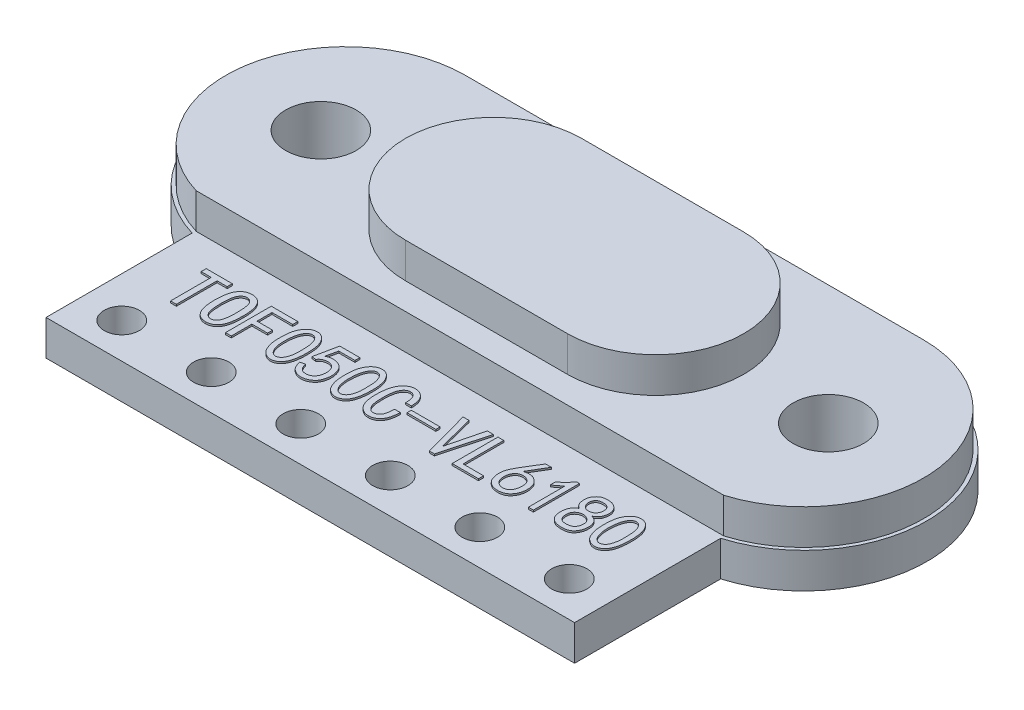
from build123d import *

# Parameters (mm, degrees)
EXTRUDE_1_DEPTH     = 1
EXTRUDE_3_DEPTH     = 1
EXTRUDE_4_DEPTH     = 1
SKETCH_4_R          = 1
CUT_EXTRUDE_1_DEPTH = 13.854960132
SKETCH_5_R          = 0.5
CUT_EXTRUDE_2_DEPTH = 13.658988901
SKETCH_6_W          = 0.818518518
SKETCH_6_H          = 0.121637426
EXTRUDE_5_DEPTH     = 0.05


with BuildPart() as part:
    # 草图1 → 凸台-拉伸1 (new body)
    with BuildSketch(Plane(origin=(0, 0, 0), x_dir=(1, 0, 0), z_dir=(0, 1, 0))):
        with BuildLine():
            Line((-6.5, 3.5), (6.5, 3.5))
            ThreePointArc((6.5, 3.5), (9.963333429, 0.505293538), (7.5, -3.354101966))
            Line((7.5, -3.354101966), (7.5, -7.5))
            Line((7.5, -7.5), (-7.5, -7.5))
            Line((-7.5, -7.5), (-7.5, -3.354101966))
            ThreePointArc((-7.5, -3.354101966), (-9.963333429, 0.505293538), (-6.5, 3.5))
        make_face()
    extrude(amount=EXTRUDE_1_DEPTH)

    # 草图2 → 凸台-拉伸3 (add)
    with BuildSketch(Plane(origin=(0, 1, 0), x_dir=(1, 0, 0), z_dir=(0, 1, 0))):
        with BuildLine():
            Line((-7.485302184, -3.254101966), (7.485302184, -3.254101966))
            ThreePointArc((7.485302184, -3.254101966), (9.863327719, 0.498022748), (6.5, 3.4))
            Line((6.5, 3.4), (-6.5, 3.4))
            ThreePointArc((-6.5, 3.4), (-9.863327719, 0.498022748), (-7.485302184, -3.254101966))
        make_face()
    extrude(amount=EXTRUDE_3_DEPTH)

    # 草图3 → 凸台-拉伸4 (add)
    with BuildSketch(Plane(origin=(0, 2, 0), x_dir=(1, 0, 0), z_dir=(0, 1, 0))):
        with BuildLine():
            Line((-2.3, 2.5), (2.3, 2.5))
            ThreePointArc((2.3, 2.5), (4.8, 0), (2.3, -2.5))
            Line((2.3, -2.5), (-2.3, -2.5))
            ThreePointArc((-2.3, -2.5), (-4.8, 0), (-2.3, 2.5))
        make_face()
    extrude(amount=EXTRUDE_4_DEPTH)

    # 草图4 → 切除-拉伸1 (cut, through all)
    with BuildSketch(Plane.XZ):
        with Locations(Location((-7.2, 0, 0), (0, 0, 270))):
            Circle(SKETCH_4_R)
        with Locations(Location((7.2, 0, 0), (0, 0, 270))):
            Circle(SKETCH_4_R)
    extrude(amount=-CUT_EXTRUDE_1_DEPTH, mode=Mode.SUBTRACT)

    # 草图5 → 切除-拉伸2 (cut, through all)
    with BuildSketch(Plane(origin=(0, 1, 0), x_dir=(1, 0, 0), z_dir=(0, 1, 0))):
        with Locations(Location((-6.35, -6.5, 0), (0, 0, 270))):
            Circle(SKETCH_5_R)
        with Locations(Location((-3.81, -6.5, 0), (0, 0, 270))):
            Circle(SKETCH_5_R)
        with Locations(Location((-1.27, -6.5, 0), (0, 0, 270))):
            Circle(SKETCH_5_R)
        with Locations(Location((1.27, -6.5, 0), (0, 0, 270))):
            Circle(SKETCH_5_R)
        with Locations(Location((3.81, -6.5, 0), (0, 0, 270))):
            Circle(SKETCH_5_R)
        with Locations(Location((6.35, -6.5, 0), (0, 0, 270))):
            Circle(SKETCH_5_R)
    extrude(amount=-CUT_EXTRUDE_2_DEPTH, mode=Mode.SUBTRACT)

    # 草图6 → 凸台-拉伸5 (add)
    # profile 1 of 14: a face of its own
    with BuildSketch(Plane(origin=(0, 1, 0), x_dir=(1, 0, 0), z_dir=(0, 1, 0))):
        with BuildLine():
            add(Edge.make_bspline(
                [(-3.633080442, -4.643944267), (-3.632330726, -4.627607531), (-3.63086882, -4.5957518), (-3.627147705, -4.549278769), (-3.622523731, -4.505297518), (-3.616261021, -4.463993877), (-3.609127974, -4.425322528), (-3.600247573, -4.389388095), (-3.590566583, -4.355971845), (-3.57604098, -4.315288984), (-3.554365395, -4.268527129), (-3.523773989, -4.216793228), (-3.487682356, -4.170680141), (-3.453885737, -4.13639764), (-3.424240438, -4.112640888), (-3.400765804, -4.097115691), (-3.376174937, -4.083698938), (-3.350189946, -4.073028683), (-3.32291437, -4.064845069), (-3.294453894, -4.058988666), (-3.264800874, -4.055277412), (-3.234276453, -4.054185292), (-3.203597885, -4.055696126), (-3.173488541, -4.060704433), (-3.144524388, -4.069623482), (-3.116491669, -4.08183178), (-3.089408684, -4.097301206), (-3.063516072, -4.116483431), (-3.038782845, -4.139179431), (-3.015013662, -4.164869397), (-2.993032587, -4.193347781), (-2.972234927, -4.223394889), (-2.954090882, -4.255666086), (-2.937610274, -4.28943796), (-2.92365032, -4.325221612), (-2.911142926, -4.362551431), (-2.901110615, -4.401826642), (-2.890141792, -4.457302648), (-2.880584106, -4.530865922), (-2.873491351, -4.62391753), (-2.871839589, -4.72317214), (-2.874112577, -4.809006098), (-2.878363663, -4.878567483), (-2.883401336, -4.929010253), (-2.890164727, -4.976902235), (-2.898382976, -5.022347805), (-2.907640223, -5.065415569), (-2.91941822, -5.105819701), (-2.932274416, -5.143818407), (-2.946515595, -5.179513744), (-2.962834746, -5.21245028), (-2.980994382, -5.242868466), (-3.000879215, -5.270801309), (-3.022910288, -5.296036893), (-3.047134343, -5.318378819), (-3.072932554, -5.338437864), (-3.100805688, -5.355731875), (-3.130141674, -5.370193632), (-3.160386096, -5.381979637), (-3.191192671, -5.389354946), (-3.221838159, -5.393948497), (-3.252567253, -5.39393759), (-3.283337892, -5.39111493), (-3.314006293, -5.383642225), (-3.344835419, -5.373442007), (-3.374869636, -5.358916735), (-3.403711227, -5.342086341), (-3.431137856, -5.324281817), (-3.456056052, -5.304723756), (-3.478588132, -5.283760821), (-3.499301496, -5.261817741), (-3.517722008, -5.238437087), (-3.533437949, -5.213460764), (-3.551802797, -5.178789561), (-3.570690532, -5.133563489), (-3.590786293, -5.078200294), (-3.606510204, -5.021270497), (-3.617576873, -4.972623081), (-3.623737112, -4.931671084), (-3.628098052, -4.89827964), (-3.63103011, -4.862191969), (-3.63326203, -4.823607513), (-3.634760146, -4.782393634), (-3.634779054, -4.738551181), (-3.634741378, -4.692081415), (-3.633643872, -4.660273557), (-3.633080442, -4.643944267)],
                knots=[0, 0, 0, 0, 1.202255831, 2.344332323, 3.427150622, 4.452790298, 5.415003786, 6.317070168, 7.172984564, 7.971810714, 9.490878293, 10.954732582, 12.380574024, 13.785796076, 14.483032935, 15.170088599, 15.852415483, 16.53926321, 17.231256195, 17.943090795, 18.673153424, 19.425791521, 20.185951937, 20.927853667, 21.663471394, 22.408255551, 23.171697317, 23.95146084, 24.772102557, 25.636403722, 26.521203059, 27.41499732, 28.320514408, 29.240196752, 30.175587258, 31.142244034, 32.133030811, 33.153387789, 35.298346624, 37.58196799, 40.011350989, 42.592982516, 43.892877383, 45.134258893, 46.318940759, 47.447766099, 48.529264423, 49.555762579, 50.539895176, 51.477852753, 52.378942115, 53.239267683, 54.079914708, 54.896514045, 55.697245284, 56.499135216, 57.295663269, 58.104176105, 58.901301703, 59.676164857, 60.428549859, 61.173813336, 61.929765436, 62.694702561, 63.488985814, 64.313130295, 65.141625222, 65.943515154, 66.715145528, 67.467119072, 68.204288601, 68.931737788, 69.651488187, 70.370742264, 71.814091361, 73.250214366, 74.698503296, 76.153483485, 76.914707982, 77.742340402, 78.62883324, 79.575783614, 80.583816845, 81.660284507, 82.798853591, 84, 84, 84, 84], degree=3))
        make_face()
        with BuildLine():
            add(Edge.make_bspline(
                [(-3.482159931, -4.598330232), (-3.483800652, -4.615495428), (-3.487033231, -4.649314621), (-3.48941825, -4.69948181), (-3.490342049, -4.748218019), (-3.489474891, -4.795550648), (-3.487098539, -4.841408961), (-3.482454757, -4.885822975), (-3.476403201, -4.928886342), (-3.468294162, -4.970331775), (-3.458440011, -5.009469152), (-3.447622719, -5.046058704), (-3.434961726, -5.079538917), (-3.420921194, -5.110065233), (-3.405447089, -5.137689683), (-3.388150331, -5.162111272), (-3.36997648, -5.184185065), (-3.349896321, -5.202527665), (-3.329524717, -5.218211678), (-3.308459602, -5.230185502), (-3.287326409, -5.238685255), (-3.266096278, -5.243974842), (-3.24470674, -5.245637595), (-3.223097472, -5.244007224), (-3.201497525, -5.238430112), (-3.180121276, -5.229658628), (-3.159458653, -5.217847638), (-3.139900492, -5.20347889), (-3.121992475, -5.186224334), (-3.105369119, -5.166574385), (-3.090485992, -5.144075769), (-3.076889018, -5.119261456), (-3.065150509, -5.091627074), (-3.050933958, -5.05128805), (-3.036586753, -4.997534266), (-3.024169596, -4.930314738), (-3.016913801, -4.860261168), (-3.014846491, -4.788401375), (-3.015584844, -4.716946421), (-3.017893034, -4.647765441), (-3.021260007, -4.581956545), (-3.025580129, -4.519211972), (-3.03343687, -4.459407664), (-3.046484708, -4.402480763), (-3.065739968, -4.348643605), (-3.085402336, -4.306115967), (-3.104219607, -4.275136928), (-3.119118088, -4.254542357), (-3.135454655, -4.237015394), (-3.153015088, -4.222446074), (-3.171718935, -4.211086003), (-3.191550479, -4.202734684), (-3.212528642, -4.197427717), (-3.234399614, -4.194903642), (-3.256519811, -4.195353254), (-3.278158979, -4.199381034), (-3.299043159, -4.206644038), (-3.319447409, -4.216738455), (-3.338903049, -4.230501603), (-3.357680962, -4.247338364), (-3.375584837, -4.267507325), (-3.393165435, -4.290598052), (-3.409439311, -4.317202439), (-3.424406361, -4.347123882), (-3.437476477, -4.380685843), (-3.449653403, -4.417469388), (-3.459896581, -4.457879117), (-3.468863014, -4.501572816), (-3.476507245, -4.548728921), (-3.480232584, -4.5814181), (-3.482159931, -4.598330232)],
                knots=[0, 0, 0, 0, 1.397316454, 2.753019234, 4.069157296, 5.347268292, 6.589031144, 7.78945144, 8.965229626, 10.112413484, 11.210110698, 12.235224056, 13.202966579, 14.108246767, 14.956441338, 15.764675174, 16.531168957, 17.268537609, 17.963781677, 18.611012722, 19.225453902, 19.804754603, 20.377071587, 20.956971254, 21.552864027, 22.177207148, 22.824438192, 23.477099645, 24.138873049, 24.835239721, 25.558866027, 26.321348508, 27.125383512, 27.989091723, 29.786373172, 31.627419599, 33.524192847, 35.487886982, 37.450446387, 39.315054396, 41.097335608, 42.790942677, 44.411021533, 45.981188455, 47.513666399, 49.037967233, 49.768516827, 50.448573276, 51.094372392, 51.705035266, 52.29207487, 52.861401646, 53.442547178, 54.039797782, 54.640911, 55.228738577, 55.81567961, 56.427998362, 57.06735936, 57.740746751, 58.467842942, 59.249806401, 60.089981822, 60.991451096, 61.957607916, 63.006379991, 64.129943241, 65.333828934, 66.620624917, 68, 68, 68, 68], degree=3))
        make_face(mode=Mode.SUBTRACT)
    # profile 2 of 14: a face of its own
    with BuildSketch(Plane(origin=(0, 1, 0), x_dir=(1, 0, 0), z_dir=(0, 1, 0))):
        with BuildLine():
            add(Edge.make_bspline(
                [(-1.795003769, -4.643944267), (-1.794254053, -4.627607531), (-1.792792147, -4.5957518), (-1.789071032, -4.549278769), (-1.784447058, -4.505297518), (-1.778184348, -4.463993877), (-1.771051301, -4.425322528), (-1.7621709, -4.389388095), (-1.75248991, -4.355971845), (-1.737964307, -4.315288984), (-1.716288722, -4.268527129), (-1.685697316, -4.216793228), (-1.649605683, -4.170680141), (-1.615809064, -4.13639764), (-1.586163765, -4.112640888), (-1.562689131, -4.097115691), (-1.538098264, -4.083698938), (-1.512113273, -4.073028683), (-1.484837697, -4.064845069), (-1.45637722, -4.058988666), (-1.426724201, -4.055277412), (-1.39619978, -4.054185292), (-1.365521212, -4.055696126), (-1.335411868, -4.060704433), (-1.306447715, -4.069623482), (-1.278414996, -4.08183178), (-1.251332011, -4.097301206), (-1.225439399, -4.116483431), (-1.200706172, -4.139179431), (-1.176936989, -4.164869397), (-1.154955914, -4.193347781), (-1.134158254, -4.223394889), (-1.116014209, -4.255666086), (-1.099533601, -4.28943796), (-1.085573647, -4.325221612), (-1.073066252, -4.362551431), (-1.063033942, -4.401826642), (-1.052065119, -4.457302648), (-1.042507433, -4.530865922), (-1.035414678, -4.62391753), (-1.033762915, -4.72317214), (-1.036035904, -4.809006098), (-1.04028699, -4.878567483), (-1.045324663, -4.929010253), (-1.052088054, -4.976902235), (-1.060306303, -5.022347805), (-1.069563549, -5.065415569), (-1.081341547, -5.105819701), (-1.094197743, -5.143818407), (-1.108438922, -5.179513744), (-1.124758073, -5.21245028), (-1.142917709, -5.242868466), (-1.162802542, -5.270801309), (-1.184833615, -5.296036893), (-1.209057669, -5.318378819), (-1.234855881, -5.338437864), (-1.262729015, -5.355731875), (-1.292065001, -5.370193632), (-1.322309423, -5.381979637), (-1.353115998, -5.389354946), (-1.383761486, -5.393948497), (-1.41449058, -5.39393759), (-1.445261219, -5.39111493), (-1.47592962, -5.383642225), (-1.506758746, -5.373442007), (-1.536792963, -5.358916735), (-1.565634554, -5.342086341), (-1.593061183, -5.324281817), (-1.617979379, -5.304723756), (-1.640511459, -5.283760821), (-1.661224823, -5.261817741), (-1.679645335, -5.238437087), (-1.695361275, -5.213460764), (-1.713726124, -5.178789561), (-1.732613859, -5.133563489), (-1.75270962, -5.078200294), (-1.76843353, -5.021270497), (-1.7795002, -4.972623081), (-1.785660439, -4.931671084), (-1.790021378, -4.89827964), (-1.792953437, -4.862191969), (-1.795185357, -4.823607513), (-1.796683473, -4.782393634), (-1.796702381, -4.738551181), (-1.796664705, -4.692081415), (-1.795567199, -4.660273557), (-1.795003769, -4.643944267)],
                knots=[0, 0, 0, 0, 1.202255831, 2.344332323, 3.427150622, 4.452790298, 5.415003786, 6.317070168, 7.172984564, 7.971810714, 9.490878293, 10.954732582, 12.380574024, 13.785796076, 14.483032935, 15.170088599, 15.852415483, 16.53926321, 17.231256195, 17.943090795, 18.673153424, 19.425791521, 20.185951937, 20.927853667, 21.663471394, 22.408255551, 23.171697317, 23.95146084, 24.772102557, 25.636403722, 26.521203059, 27.41499732, 28.320514408, 29.240196752, 30.175587258, 31.142244034, 32.133030811, 33.153387789, 35.298346624, 37.58196799, 40.011350989, 42.592982516, 43.892877383, 45.134258893, 46.318940759, 47.447766099, 48.529264423, 49.555762579, 50.539895176, 51.477852753, 52.378942115, 53.239267683, 54.079914708, 54.896514045, 55.697245284, 56.499135216, 57.295663269, 58.104176105, 58.901301703, 59.676164857, 60.428549859, 61.173813336, 61.929765436, 62.694702561, 63.488985814, 64.313130295, 65.141625222, 65.943515154, 66.715145528, 67.467119072, 68.204288601, 68.931737788, 69.651488187, 70.370742264, 71.814091361, 73.250214366, 74.698503296, 76.153483485, 76.914707982, 77.742340402, 78.62883324, 79.575783614, 80.583816845, 81.660284507, 82.798853591, 84, 84, 84, 84], degree=3))
        make_face()
        with BuildLine():
            add(Edge.make_bspline(
                [(-1.644083258, -4.598330232), (-1.645723979, -4.615495428), (-1.648956558, -4.649314621), (-1.651341577, -4.69948181), (-1.652265376, -4.748218019), (-1.651398218, -4.795550648), (-1.649021866, -4.841408961), (-1.644378083, -4.885822975), (-1.638326527, -4.928886342), (-1.630217489, -4.970331775), (-1.620363338, -5.009469152), (-1.609546046, -5.046058704), (-1.596885053, -5.079538917), (-1.582844521, -5.110065233), (-1.567370416, -5.137689683), (-1.550073657, -5.162111272), (-1.531899807, -5.184185065), (-1.511819648, -5.202527665), (-1.491448044, -5.218211678), (-1.470382929, -5.230185502), (-1.449249736, -5.238685255), (-1.428019605, -5.243974842), (-1.406630067, -5.245637595), (-1.385020799, -5.244007224), (-1.363420851, -5.238430112), (-1.342044603, -5.229658628), (-1.32138198, -5.217847638), (-1.301823819, -5.20347889), (-1.283915802, -5.186224334), (-1.267292446, -5.166574385), (-1.252409318, -5.144075769), (-1.238812345, -5.119261456), (-1.227073836, -5.091627074), (-1.212857285, -5.05128805), (-1.19851008, -4.997534266), (-1.186092923, -4.930314738), (-1.178837127, -4.860261168), (-1.176769818, -4.788401375), (-1.177508171, -4.716946421), (-1.179816361, -4.647765441), (-1.183183334, -4.581956545), (-1.187503456, -4.519211972), (-1.195360196, -4.459407664), (-1.208408035, -4.402480763), (-1.227663295, -4.348643605), (-1.247325663, -4.306115967), (-1.266142934, -4.275136928), (-1.281041415, -4.254542357), (-1.297377981, -4.237015394), (-1.314938414, -4.222446074), (-1.333642262, -4.211086003), (-1.353473806, -4.202734684), (-1.374451969, -4.197427717), (-1.396322941, -4.194903642), (-1.418443137, -4.195353254), (-1.440082306, -4.199381034), (-1.460966486, -4.206644038), (-1.481370735, -4.216738455), (-1.500826376, -4.230501603), (-1.519604288, -4.247338364), (-1.537508164, -4.267507325), (-1.555088762, -4.290598052), (-1.571362637, -4.317202439), (-1.586329688, -4.347123882), (-1.599399804, -4.380685843), (-1.61157673, -4.417469388), (-1.621819908, -4.457879117), (-1.63078634, -4.501572816), (-1.638430572, -4.548728921), (-1.64215591, -4.5814181), (-1.644083258, -4.598330232)],
                knots=[0, 0, 0, 0, 1.397316454, 2.753019234, 4.069157296, 5.347268292, 6.589031144, 7.78945144, 8.965229626, 10.112413484, 11.210110698, 12.235224056, 13.202966579, 14.108246767, 14.956441338, 15.764675174, 16.531168957, 17.268537609, 17.963781677, 18.611012722, 19.225453902, 19.804754603, 20.377071587, 20.956971254, 21.552864027, 22.177207148, 22.824438192, 23.477099645, 24.138873049, 24.835239721, 25.558866027, 26.321348508, 27.125383512, 27.989091723, 29.786373172, 31.627419599, 33.524192847, 35.487886982, 37.450446387, 39.315054396, 41.097335608, 42.790942677, 44.411021533, 45.981188455, 47.513666399, 49.037967233, 49.768516827, 50.448573276, 51.094372392, 51.705035266, 52.29207487, 52.861401646, 53.442547178, 54.039797782, 54.640911, 55.228738577, 55.81567961, 56.427998362, 57.06735936, 57.740746751, 58.467842942, 59.249806401, 60.089981822, 60.991451096, 61.957607916, 63.006379991, 64.129943241, 65.333828934, 66.620624917, 68, 68, 68, 68], degree=3))
        make_face(mode=Mode.SUBTRACT)
    # profile 3 of 14: a face of its own
    with BuildSketch(Plane(origin=(0, 1, 0), x_dir=(1, 0, 0), z_dir=(0, 1, 0))):
        with BuildLine():
            add(Edge.make_bspline(
                [(5.557302923, -4.643944267), (5.55805264, -4.627607531), (5.559514546, -4.5957518), (5.563235661, -4.549278769), (5.567859635, -4.505297518), (5.574122345, -4.463993877), (5.581255392, -4.425322528), (5.590135793, -4.389388095), (5.599816783, -4.355971845), (5.614342386, -4.315288984), (5.636017971, -4.268527129), (5.666609377, -4.216793228), (5.70270101, -4.170680141), (5.736497629, -4.13639764), (5.766142928, -4.112640888), (5.789617561, -4.097115691), (5.814208429, -4.083698938), (5.84019342, -4.073028683), (5.867468996, -4.064845069), (5.895929472, -4.058988666), (5.925582492, -4.055277412), (5.956106913, -4.054185292), (5.986785481, -4.055696126), (6.016894824, -4.060704433), (6.045858977, -4.069623482), (6.073891697, -4.08183178), (6.100974682, -4.097301206), (6.126867294, -4.116483431), (6.151600521, -4.139179431), (6.175369703, -4.164869397), (6.197350779, -4.193347781), (6.218148439, -4.223394889), (6.236292484, -4.255666086), (6.252773092, -4.28943796), (6.266733046, -4.325221612), (6.27924044, -4.362551431), (6.289272751, -4.401826642), (6.300241574, -4.457302648), (6.30979926, -4.530865922), (6.316892014, -4.62391753), (6.318543777, -4.72317214), (6.316270788, -4.809006098), (6.312019703, -4.878567483), (6.30698203, -4.929010253), (6.300218638, -4.976902235), (6.29200039, -5.022347805), (6.282743143, -5.065415569), (6.270965146, -5.105819701), (6.258108949, -5.143818407), (6.243867771, -5.179513744), (6.22754862, -5.21245028), (6.209388984, -5.242868466), (6.189504151, -5.270801309), (6.167473078, -5.296036893), (6.143249023, -5.318378819), (6.117450811, -5.338437864), (6.089577677, -5.355731875), (6.060241692, -5.370193632), (6.02999727, -5.381979637), (5.999190695, -5.389354946), (5.968545207, -5.393948497), (5.937816113, -5.39393759), (5.907045474, -5.39111493), (5.876377072, -5.383642225), (5.845547947, -5.373442007), (5.81551373, -5.358916735), (5.786672139, -5.342086341), (5.75924551, -5.324281817), (5.734327313, -5.304723756), (5.711795234, -5.283760821), (5.69108187, -5.261817741), (5.672661358, -5.238437087), (5.656945417, -5.213460764), (5.638580568, -5.178789561), (5.619692834, -5.133563489), (5.599597073, -5.078200294), (5.583873162, -5.021270497), (5.572806493, -4.972623081), (5.566646254, -4.931671084), (5.562285314, -4.89827964), (5.559353256, -4.862191969), (5.557121336, -4.823607513), (5.55562322, -4.782393634), (5.555604312, -4.738551181), (5.555641987, -4.692081415), (5.556739493, -4.660273557), (5.557302923, -4.643944267)],
                knots=[0, 0, 0, 0, 1.202255831, 2.344332323, 3.427150622, 4.452790298, 5.415003786, 6.317070168, 7.172984564, 7.971810714, 9.490878293, 10.954732582, 12.380574024, 13.785796076, 14.483032935, 15.170088599, 15.852415483, 16.53926321, 17.231256195, 17.943090795, 18.673153424, 19.425791521, 20.185951937, 20.927853667, 21.663471394, 22.408255551, 23.171697317, 23.95146084, 24.772102557, 25.636403722, 26.521203059, 27.41499732, 28.320514408, 29.240196752, 30.175587258, 31.142244034, 32.133030811, 33.153387789, 35.298346624, 37.58196799, 40.011350989, 42.592982516, 43.892877383, 45.134258893, 46.318940759, 47.447766099, 48.529264423, 49.555762579, 50.539895176, 51.477852753, 52.378942115, 53.239267683, 54.079914708, 54.896514045, 55.697245284, 56.499135216, 57.295663269, 58.104176105, 58.901301703, 59.676164857, 60.428549859, 61.173813336, 61.929765436, 62.694702561, 63.488985814, 64.313130295, 65.141625222, 65.943515154, 66.715145528, 67.467119072, 68.204288601, 68.931737788, 69.651488187, 70.370742264, 71.814091361, 73.250214366, 74.698503296, 76.153483485, 76.914707982, 77.742340402, 78.62883324, 79.575783614, 80.583816845, 81.660284507, 82.798853591, 84, 84, 84, 84], degree=3))
        make_face()
        with BuildLine():
            add(Edge.make_bspline(
                [(5.708223435, -4.598330232), (5.706582714, -4.615495428), (5.703350135, -4.649314621), (5.700965116, -4.69948181), (5.700041316, -4.748218019), (5.700908474, -4.795550648), (5.703284827, -4.841408961), (5.707928609, -4.885822975), (5.713980165, -4.928886342), (5.722089204, -4.970331775), (5.731943354, -5.009469152), (5.742760646, -5.046058704), (5.755421639, -5.079538917), (5.769462172, -5.110065233), (5.784936277, -5.137689683), (5.802233035, -5.162111272), (5.820406886, -5.184185065), (5.840487045, -5.202527665), (5.860858649, -5.218211678), (5.881923764, -5.230185502), (5.903056957, -5.238685255), (5.924287087, -5.243974842), (5.945676626, -5.245637595), (5.967285894, -5.244007224), (5.988885841, -5.238430112), (6.01026209, -5.229658628), (6.030924712, -5.217847638), (6.050482874, -5.20347889), (6.068390891, -5.186224334), (6.085014247, -5.166574385), (6.099897374, -5.144075769), (6.113494347, -5.119261456), (6.125232857, -5.091627074), (6.139449408, -5.05128805), (6.153796613, -4.997534266), (6.16621377, -4.930314738), (6.173469565, -4.860261168), (6.175536875, -4.788401375), (6.174798522, -4.716946421), (6.172490331, -4.647765441), (6.169123359, -4.581956545), (6.164803237, -4.519211972), (6.156946496, -4.459407664), (6.143898658, -4.402480763), (6.124643398, -4.348643605), (6.104981029, -4.306115967), (6.086163759, -4.275136928), (6.071265278, -4.254542357), (6.054928711, -4.237015394), (6.037368278, -4.222446074), (6.018664431, -4.211086003), (5.998832887, -4.202734684), (5.977854724, -4.197427717), (5.955983751, -4.194903642), (5.933863555, -4.195353254), (5.912224386, -4.199381034), (5.891340206, -4.206644038), (5.870935957, -4.216738455), (5.851480316, -4.230501603), (5.832702404, -4.247338364), (5.814798529, -4.267507325), (5.79721793, -4.290598052), (5.780944055, -4.317202439), (5.765977005, -4.347123882), (5.752906889, -4.380685843), (5.740729963, -4.417469388), (5.730486784, -4.457879117), (5.721520352, -4.501572816), (5.713876121, -4.548728921), (5.710150782, -4.5814181), (5.708223435, -4.598330232)],
                knots=[0, 0, 0, 0, 1.397316454, 2.753019234, 4.069157296, 5.347268292, 6.589031144, 7.78945144, 8.965229626, 10.112413484, 11.210110698, 12.235224056, 13.202966579, 14.108246767, 14.956441338, 15.764675174, 16.531168957, 17.268537609, 17.963781677, 18.611012722, 19.225453902, 19.804754603, 20.377071587, 20.956971254, 21.552864027, 22.177207148, 22.824438192, 23.477099645, 24.138873049, 24.835239721, 25.558866027, 26.321348508, 27.125383512, 27.989091723, 29.786373172, 31.627419599, 33.524192847, 35.487886982, 37.450446387, 39.315054396, 41.097335608, 42.790942677, 44.411021533, 45.981188455, 47.513666399, 49.037967233, 49.768516827, 50.448573276, 51.094372392, 51.705035266, 52.29207487, 52.861401646, 53.442547178, 54.039797782, 54.640911, 55.228738577, 55.81567961, 56.427998362, 57.06735936, 57.740746751, 58.467842942, 59.249806401, 60.089981822, 60.991451096, 61.957607916, 63.006379991, 64.129943241, 65.333828934, 66.620624917, 68, 68, 68, 68], degree=3))
        make_face(mode=Mode.SUBTRACT)
    # profile 4 of 14: a face of its own
    with BuildSketch(Plane(origin=(0, 1, 0), x_dir=(1, 0, 0), z_dir=(0, 1, 0))):
        Polygon((-5.636156033, -4.221873658), (-5.923355513, -4.221873658), (-5.923355513, -5.377429214), (-6.08835443, -5.377429214), (-6.08835443, -4.221873658), (-6.37555391, -4.221873658), (-6.37555391, -4.077429214), (-5.636156033, -4.077429214), align=None)
    # profile 5 of 14: a face of its own
    with BuildSketch(Plane(origin=(0, 1, 0), x_dir=(1, 0, 0), z_dir=(0, 1, 0))):
        with BuildLine():
            add(Edge.make_bspline(
                [(-4.688397748, -4.723628044), (-4.6887293, -4.752353899), (-4.689369059, -4.807782938), (-4.69403033, -4.887764176), (-4.702205629, -4.961428143), (-4.713073403, -5.028971075), (-4.728090014, -5.090063154), (-4.745567213, -5.145134939), (-4.766583859, -5.193946224), (-4.791241197, -5.236548732), (-4.818744622, -5.273508689), (-4.848787579, -5.305385118), (-4.881393867, -5.332374062), (-4.916575431, -5.354691241), (-4.954683728, -5.371588317), (-4.995270148, -5.383699719), (-5.038392816, -5.391204748), (-5.068014635, -5.392150472), (-5.083156249, -5.392633892)],
                knots=[0, 0, 0, 0, 1.575814199, 3.040670848, 4.392759093, 5.640420767, 6.790536865, 7.84073895, 8.806849797, 9.699660947, 10.534787483, 11.328761039, 12.096767937, 12.851017334, 13.606951893, 14.375786756, 15.169760312, 16, 16, 16, 16], degree=3))
            add(Edge.make_bspline(
                [(-5.083156249, -5.392633892), (-5.098297404, -5.392145883), (-5.128010886, -5.391188197), (-5.171318757, -5.383697527), (-5.212189538, -5.371597016), (-5.250632469, -5.354635617), (-5.286346191, -5.332317453), (-5.319761874, -5.305423026), (-5.350656925, -5.273547833), (-5.378987678, -5.236586562), (-5.404595405, -5.194071062), (-5.42597206, -5.14508936), (-5.444702396, -5.090243153), (-5.459194267, -5.028884731), (-5.471035871, -4.961485775), (-5.479267397, -4.887762164), (-5.484358059, -4.807795476), (-5.484936025, -4.752356208), (-5.485235522, -4.723628044)],
                knots=[0, 0, 0, 0, 0.826368182, 1.621691169, 2.391849926, 3.148939623, 3.908367225, 4.684707456, 5.485624427, 6.326141133, 7.222601148, 8.188349311, 9.238504517, 10.383257488, 11.626834111, 12.973192974, 14.431534009, 16, 16, 16, 16], degree=3))
            add(Edge.make_bspline(
                [(-5.485235522, -4.723628044), (-5.484937464, -4.694899888), (-5.484363249, -4.63955431), (-5.479272499, -4.559773919), (-5.471023318, -4.486334963), (-5.459273879, -4.419383713), (-5.444663629, -4.358607322), (-5.425953417, -4.304423573), (-5.404755071, -4.256072148), (-5.378885409, -4.214548852), (-5.350670175, -4.178438214), (-5.319650675, -4.147448586), (-5.286345932, -4.121081002), (-5.250533975, -4.099419485), (-5.212186968, -4.082653088), (-5.171268035, -4.070975307), (-5.128025828, -4.063295366), (-5.098300838, -4.062585967), (-5.083156249, -4.062224536)],
                knots=[0, 0, 0, 0, 1.578860414, 3.041717743, 4.391874286, 5.638611742, 6.775922934, 7.823275337, 8.786016059, 9.670786588, 10.504660206, 11.299867464, 12.074924174, 12.834004698, 13.594031204, 14.367833651, 15.168427344, 16, 16, 16, 16], degree=3))
            add(Edge.make_bspline(
                [(-5.083156249, -4.062224536), (-5.068011161, -4.062581244), (-5.038377808, -4.063279191), (-4.995321201, -4.070972784), (-4.954686138, -4.082661722), (-4.916675625, -4.09936367), (-4.881395524, -4.121024845), (-4.848897976, -4.147483288), (-4.818730525, -4.178477885), (-4.791341234, -4.214584074), (-4.766424498, -4.256202268), (-4.74558598, -4.304376972), (-4.728126218, -4.358788548), (-4.712995394, -4.419297048), (-4.702218558, -4.486392998), (-4.694025175, -4.559771853), (-4.689364275, -4.639566934), (-4.688728035, -4.694902222), (-4.688397748, -4.723628044)],
                knots=[0, 0, 0, 0, 0.835532803, 1.634829595, 2.407342517, 3.166241811, 3.920079529, 4.686674999, 5.474750598, 6.303065712, 7.183989486, 8.147084175, 9.194472646, 10.337199986, 11.588114816, 12.944116777, 14.413620675, 16, 16, 16, 16], degree=3))
        make_face()
        with BuildLine():
            add(Edge.make_bspline(
                [(-4.860717436, -4.723628044), (-4.860973261, -4.698191449), (-4.86146242, -4.649554481), (-4.864037396, -4.580039272), (-4.869128497, -4.517395696), (-4.875845069, -4.461508371), (-4.885154191, -4.412548743), (-4.895733937, -4.370281065), (-4.908818895, -4.334963222), (-4.92423079, -4.306101062), (-4.941509644, -4.282668616), (-4.958727365, -4.262215958), (-4.97720524, -4.245136678), (-4.996585509, -4.231156299), (-5.016824859, -4.219954564), (-5.038279397, -4.212486345), (-5.060382859, -4.207297718), (-5.07552364, -4.206879705), (-5.083156249, -4.20666898)],
                knots=[0, 0, 0, 0, 1.963269092, 3.753940191, 5.367329203, 6.812978459, 8.095858007, 9.211536051, 10.172118002, 10.995359499, 11.727121309, 12.41539158, 13.056166358, 13.663302938, 14.256450332, 14.833863709, 15.412139745, 16, 16, 16, 16], degree=3))
            add(Edge.make_bspline(
                [(-5.083156249, -4.20666898), (-5.090884413, -4.20687071), (-5.106122381, -4.207268471), (-5.12838901, -4.212538554), (-5.150060205, -4.219921696), (-5.170637548, -4.231315167), (-5.190777991, -4.244995919), (-5.20982425, -4.262287012), (-5.227915303, -4.282618463), (-5.24601301, -4.306049135), (-5.262363342, -4.334831508), (-5.275914583, -4.370258327), (-5.287196945, -4.412483618), (-5.29655961, -4.461529317), (-5.30408364, -4.517357702), (-5.309273713, -4.580038396), (-5.312264078, -4.649546178), (-5.312692035, -4.698189967), (-5.312915833, -4.723628044)],
                knots=[0, 0, 0, 0, 0.591398625, 1.166087189, 1.746696835, 2.34250422, 2.963523994, 3.610976646, 4.309261031, 5.049304105, 5.877917875, 6.837737957, 7.950227515, 9.226509397, 10.665064709, 12.269042512, 14.048910508, 16, 16, 16, 16], degree=3))
            add(Edge.make_bspline(
                [(-5.312915833, -4.723628044), (-5.312690259, -4.749066029), (-5.312258075, -4.797803405), (-5.309278177, -4.867499452), (-5.304057515, -4.93055142), (-5.296584369, -4.986760106), (-5.287176295, -5.036269734), (-5.27578743, -5.07909786), (-5.262426854, -5.115426829), (-5.245981615, -5.145089105), (-5.228021269, -5.169395294), (-5.209721244, -5.190278433), (-5.190885037, -5.208424359), (-5.170717961, -5.222707724), (-5.150065342, -5.234325061), (-5.128446698, -5.242125157), (-5.106104858, -5.247217638), (-5.090880573, -5.247862344), (-5.083156249, -5.248189448)],
                knots=[0, 0, 0, 0, 1.93265765, 3.702835093, 5.298765143, 6.737862613, 8.009086707, 9.124823572, 10.102159662, 10.941597642, 11.691824365, 12.394163048, 13.049964202, 13.673328396, 14.266900684, 14.844451572, 15.413711083, 16, 16, 16, 16], degree=3))
            add(Edge.make_bspline(
                [(-5.083156249, -5.248189448), (-5.075527527, -5.247853508), (-5.060400717, -5.247187379), (-5.03822056, -5.242178161), (-5.016820432, -5.234291979), (-4.996499426, -5.222866196), (-4.977103976, -5.208277874), (-4.958827379, -5.190353669), (-4.941406492, -5.169340496), (-4.924263347, -5.145039191), (-4.908760314, -5.115295505), (-4.895856653, -5.079078881), (-4.885173828, -5.036205503), (-4.87582156, -4.986780551), (-4.869152996, -4.930514097), (-4.864033299, -4.867498471), (-4.861467868, -4.797795188), (-4.860974806, -4.749064572), (-4.860717436, -4.723628044)],
                knots=[0, 0, 0, 0, 0.582703218, 1.155428208, 1.729768534, 2.320672757, 2.930480733, 3.579895491, 4.272494922, 5.014809166, 5.849148678, 6.827396544, 7.946251568, 9.223865636, 10.669874188, 12.274926644, 14.055576917, 16, 16, 16, 16], degree=3))
        make_face(mode=Mode.SUBTRACT)
    # profile 6 of 14: a face of its own
    with BuildSketch(Plane(origin=(0, 1, 0), x_dir=(1, 0, 0), z_dir=(0, 1, 0))):
        Polygon((-3.776398614, -4.221873658), (-4.365157549, -4.221873658), (-4.365157549, -4.647604653), (-3.919998355, -4.647604653), (-3.919998355, -4.792049097), (-4.365157549, -4.792049097), (-4.365157549, -5.377429214), (-4.530438034, -5.377429214), (-4.530438034, -4.077429214), (-3.776398614, -4.077429214), align=None)
    # profile 7 of 14: a face of its own
    with BuildSketch(Plane(origin=(0, 1, 0), x_dir=(1, 0, 0), z_dir=(0, 1, 0))):
        with BuildLine():
            add(Edge.make_bspline(
                [(-2.620561491, -5.012516933), (-2.616205016, -5.028732716), (-2.60790266, -5.059635957), (-2.592233825, -5.102748421), (-2.574084129, -5.140154449), (-2.553446234, -5.171764378), (-2.53083897, -5.197946437), (-2.505684532, -5.218437239), (-2.478058877, -5.233175271), (-2.44843956, -5.241194692), (-2.418974212, -5.24532154), (-2.390567917, -5.247590696), (-2.363628175, -5.248126716), (-2.338176724, -5.245792798), (-2.314093336, -5.24138109), (-2.291518671, -5.234487637), (-2.270141214, -5.225981131), (-2.244512946, -5.210683453), (-2.215670633, -5.188383354), (-2.185396151, -5.157923544), (-2.160775605, -5.123290894), (-2.142072024, -5.084898898), (-2.127940526, -5.043636332), (-2.118893031, -4.999721611), (-2.113673458, -4.953625636), (-2.113590573, -4.906172016), (-2.117652144, -4.859368102), (-2.127412683, -4.815128235), (-2.143018819, -4.77485416), (-2.163521732, -4.7386723), (-2.18840021, -4.707440313), (-2.216267812, -4.680869634), (-2.248261585, -4.661074383), (-2.282804858, -4.646432402), (-2.320282557, -4.6382344), (-2.359930906, -4.634880575), (-2.401816502, -4.63866306), (-2.437714576, -4.645181015), (-2.466497325, -4.653999013), (-2.487545968, -4.662491364), (-2.507578899, -4.672892125), (-2.526567595, -4.685431612), (-2.54453549, -4.699787516), (-2.561566456, -4.715920685), (-2.577424944, -4.734077395), (-2.586970791, -4.747293769), (-2.591841543, -4.754037401)],
                knots=[0, 0, 0, 0, 1.440772756, 2.745753867, 3.931089201, 5.001362436, 5.97747551, 6.888379651, 7.771243662, 8.643234641, 9.506849525, 10.323059292, 11.088426718, 11.816330219, 12.513120585, 13.185981879, 13.839764201, 14.482281771, 15.740703251, 16.959805272, 18.155715406, 19.369856395, 20.613101394, 21.889776103, 23.210895096, 24.5885037, 25.956064657, 27.236191491, 28.462961981, 29.6500481, 30.791195886, 31.879955865, 32.937142085, 34.00240088, 35.085063659, 36.216387077, 37.403937813, 38.683709712, 39.341154709, 39.984429399, 40.629416939, 41.275158704, 41.934427407, 42.601135756, 43.286231893, 44, 44, 44, 44], degree=3))
            Line((-2.591841543, -4.754037401), (-2.713760538, -4.738832723))
            add(Edge.make_bspline(
                [(-2.713760538, -4.738832723), (-2.712991971, -4.736209502), (-2.711026386, -4.729500699), (-2.708091138, -4.71716045), (-2.704005489, -4.700508003), (-2.699766764, -4.67938245), (-2.69393228, -4.654013019), (-2.687530717, -4.624149933), (-2.680208923, -4.589798977), (-2.672032811, -4.551151535), (-2.663367135, -4.508019904), (-2.65349468, -4.460645623), (-2.642680066, -4.408785544), (-2.631637967, -4.352482953), (-2.619103246, -4.291900583), (-2.605808518, -4.22688923), (-2.592214106, -4.157357524), (-2.582489164, -4.109615178), (-2.577481569, -4.085031553)],
                knots=[0, 0, 0, 0, 0.1964209, 0.502340227, 0.91135273, 1.428620429, 2.050489893, 2.782110173, 3.623494787, 4.574652573, 5.621016364, 6.785131302, 8.052424553, 9.428164775, 10.908423118, 12.498470141, 14.196982245, 16, 16, 16, 16], degree=3))
            Line((-2.577481569, -4.085031553), (-2.010121811, -4.085031553))
            Line((-2.010121811, -4.085031553), (-2.010121811, -4.221873658))
            Line((-2.010121811, -4.221873658), (-2.46964098, -4.221873658))
            add(Edge.make_bspline(
                [(-2.46964098, -4.221873658), (-2.47260723, -4.238586809), (-2.478378454, -4.271104412), (-2.487426029, -4.31849783), (-2.496432684, -4.363269855), (-2.505349025, -4.405436149), (-2.514509519, -4.444895855), (-2.523045303, -4.481876908), (-2.53209494, -4.51620505), (-2.538400478, -4.53817897), (-2.54144085, -4.548774243)],
                knots=[0, 0, 0, 0, 1.216602525, 2.367057976, 3.458098476, 4.489855192, 5.455924242, 6.361499988, 7.209956349, 8, 8, 8, 8], degree=3))
            add(Edge.make_bspline(
                [(-2.54144085, -4.548774243), (-2.523966014, -4.540654043), (-2.490348846, -4.525032829), (-2.438850488, -4.50920327), (-2.389210197, -4.500070845), (-2.341050845, -4.498466325), (-2.294358305, -4.503000688), (-2.248734497, -4.511861077), (-2.204074793, -4.525970292), (-2.161028448, -4.544178458), (-2.121002116, -4.56648274), (-2.08610741, -4.593144442), (-2.057034927, -4.623836446), (-2.034974742, -4.658698984), (-2.016735612, -4.694670747), (-2.000754128, -4.730808868), (-1.987876305, -4.767069818), (-1.977559623, -4.803556325), (-1.969956937, -4.84063186), (-1.964789976, -4.878911689), (-1.962630803, -4.91863246), (-1.963200967, -4.959651255), (-1.966684023, -5.001583103), (-1.972622946, -5.044304647), (-1.982909623, -5.08733364), (-1.995045885, -5.130440596), (-2.010795966, -5.171946606), (-2.030597405, -5.210229086), (-2.053982255, -5.244869038), (-2.081348025, -5.275531224), (-2.112071031, -5.302515772), (-2.145541529, -5.32714672), (-2.182553704, -5.348228414), (-2.222196697, -5.367168685), (-2.265236926, -5.381592159), (-2.31156704, -5.390950423), (-2.361072668, -5.39452499), (-2.404066005, -5.393898968), (-2.439292088, -5.389877106), (-2.465729701, -5.384775289), (-2.491916146, -5.377841889), (-2.517555678, -5.367986131), (-2.543106101, -5.356566082), (-2.568306809, -5.343033627), (-2.592908127, -5.327000389), (-2.617320757, -5.30918198), (-2.641120688, -5.288818655), (-2.66199379, -5.264049053), (-2.682022385, -5.236877439), (-2.699185113, -5.205812736), (-2.715309875, -5.17194089), (-2.728308915, -5.134271853), (-2.740847729, -5.09375527), (-2.746755824, -5.065231641), (-2.749801257, -5.050528629)],
                knots=[0, 0, 0, 0, 1.424718207, 2.740797691, 3.975324022, 5.149986995, 6.293933961, 7.440976923, 8.58342554, 9.753643849, 10.895247459, 11.96506665, 12.992202251, 14.005599374, 15.005961907, 15.976456116, 16.927793868, 17.851415661, 18.780506573, 19.726554835, 20.707557218, 21.721811014, 22.760159708, 23.820123824, 24.910359803, 26.031492208, 27.133153111, 28.189469243, 29.21444166, 30.218174859, 31.221908057, 32.236161854, 33.288175441, 34.36959065, 35.483274305, 36.638490923, 37.857975759, 39.15028482, 39.814591531, 40.479406483, 41.141639903, 41.816432049, 42.509740207, 43.212140525, 43.930838428, 44.681070132, 45.448878962, 46.24151755, 47.072434625, 47.943495222, 48.86334797, 49.845530092, 50.889440167, 52, 52, 52, 52], degree=3))
            Line((-2.749801257, -5.050528629), (-2.620561491, -5.012516933))
        make_face()
    # profile 8 of 14: a face of its own
    with BuildSketch(Plane(origin=(0, 1, 0), x_dir=(1, 0, 0), z_dir=(0, 1, 0))):
        with BuildLine():
            add(Edge.make_bspline(
                [(-0.085885294, -4.86047015), (-0.086772513, -4.883666005), (-0.088485461, -4.928450064), (-0.094827527, -4.992986881), (-0.104732827, -5.052197053), (-0.117117883, -5.106347862), (-0.133178096, -5.155253443), (-0.15218517, -5.199130567), (-0.174381084, -5.237844284), (-0.200029823, -5.271038856), (-0.227905139, -5.299496658), (-0.256835068, -5.324427986), (-0.287236692, -5.34544894), (-0.318868076, -5.362831121), (-0.352100346, -5.376071666), (-0.386619815, -5.38574827), (-0.422545847, -5.39144681), (-0.446929658, -5.392235545), (-0.459244618, -5.392633892)],
                knots=[0, 0, 0, 0, 1.528145528, 2.950378745, 4.265981389, 5.478588287, 6.604180119, 7.650129253, 8.622046627, 9.534213888, 10.403861392, 11.241023116, 12.044956697, 12.833059487, 13.612220256, 14.394852998, 15.189325959, 16, 16, 16, 16], degree=3))
            add(Edge.make_bspline(
                [(-0.459244618, -5.392633892), (-0.473355179, -5.392238565), (-0.501287557, -5.391456001), (-0.542271109, -5.384075718), (-0.58178096, -5.372673073), (-0.619378146, -5.355951106), (-0.655873139, -5.335390021), (-0.690449971, -5.309520677), (-0.723456039, -5.279165593), (-0.755025438, -5.244519091), (-0.783522949, -5.204341234), (-0.808334955, -5.158561347), (-0.829497046, -5.107238518), (-0.846402056, -5.050301248), (-0.859559749, -4.987854479), (-0.869006272, -4.919934906), (-0.874565973, -4.846390876), (-0.875302928, -4.795531601), (-0.875683865, -4.769242079)],
                knots=[0, 0, 0, 0, 0.804669796, 1.592873742, 2.369192323, 3.146452916, 3.935802839, 4.755418713, 5.604745879, 6.492271356, 7.425732613, 8.408609141, 9.458142105, 10.588488669, 11.793589906, 13.097375513, 14.499612766, 16, 16, 16, 16], degree=3))
            add(Edge.make_bspline(
                [(-0.875683865, -4.769242079), (-0.875275405, -4.740420817), (-0.874484358, -4.684603937), (-0.869273945, -4.603658726), (-0.860069897, -4.528443441), (-0.847244904, -4.458903362), (-0.830722222, -4.39505645), (-0.810621432, -4.336702036), (-0.786437147, -4.284173579), (-0.75870825, -4.237318774), (-0.728020763, -4.196156192), (-0.695032077, -4.160398211), (-0.659745202, -4.130201261), (-0.622530092, -4.105198023), (-0.58297185, -4.085735861), (-0.541218813, -4.072312494), (-0.49741168, -4.063812118), (-0.467449539, -4.062759888), (-0.452205415, -4.062224536)],
                knots=[0, 0, 0, 0, 1.503937227, 2.912609546, 4.230203999, 5.455882613, 6.599823833, 7.668566539, 8.672169072, 9.612051287, 10.504386206, 11.346493463, 12.145439094, 12.922406537, 13.680261134, 14.437609165, 15.205087498, 16, 16, 16, 16], degree=3))
            add(Edge.make_bspline(
                [(-0.452205415, -4.062224536), (-0.439325178, -4.06259682), (-0.413895087, -4.063331839), (-0.376656751, -4.069344289), (-0.341195001, -4.079304907), (-0.307276913, -4.092870459), (-0.275114828, -4.110648897), (-0.244885179, -4.132716133), (-0.215876658, -4.158031626), (-0.189366795, -4.187675923), (-0.165053233, -4.220517885), (-0.144123089, -4.256892327), (-0.126637553, -4.296427092), (-0.112913087, -4.339311893), (-0.102479272, -4.385278597), (-0.095939676, -4.434467719), (-0.092456191, -4.486779048), (-0.092951098, -4.522677599), (-0.093206065, -4.541171904)],
                knots=[0, 0, 0, 0, 0.914993068, 1.80651613, 2.67234293, 3.52822108, 4.396997458, 5.276285098, 6.183612196, 7.128082397, 8.096623096, 9.082803005, 10.104087945, 11.162972407, 12.277853957, 13.449436072, 14.685994152, 16, 16, 16, 16], degree=3))
            Line((-0.093206065, -4.541171904), (-0.251165779, -4.541171904))
            add(Edge.make_bspline(
                [(-0.251165779, -4.541171904), (-0.251341043, -4.527653501), (-0.251679655, -4.501535808), (-0.253905251, -4.463570376), (-0.257723937, -4.42820977), (-0.263381934, -4.395509249), (-0.270344669, -4.365361588), (-0.279027202, -4.337881935), (-0.289090526, -4.312816316), (-0.300997032, -4.29052297), (-0.314118113, -4.270573236), (-0.329234135, -4.253467124), (-0.345949082, -4.239048142), (-0.364045412, -4.227048816), (-0.383897531, -4.217886784), (-0.405338244, -4.211541595), (-0.428308764, -4.207483099), (-0.44411641, -4.206944559), (-0.452205415, -4.20666898)],
                knots=[0, 0, 0, 0, 1.475617466, 2.850908021, 4.149737178, 5.35570579, 6.471483601, 7.524540452, 8.498635381, 9.415273124, 10.279089284, 11.099275003, 11.898263037, 12.68253353, 13.461769064, 14.275272915, 15.117431784, 16, 16, 16, 16], degree=3))
            add(Edge.make_bspline(
                [(-0.452205415, -4.20666898), (-0.461527824, -4.207042264), (-0.479989118, -4.207781485), (-0.506897261, -4.213842348), (-0.532198072, -4.223813248), (-0.556066978, -4.237607678), (-0.578333172, -4.255564295), (-0.599174018, -4.277376699), (-0.61847983, -4.303111587), (-0.636241965, -4.332908729), (-0.6524057, -4.367238993), (-0.666142421, -4.406790155), (-0.677435749, -4.451684065), (-0.68690605, -4.50190423), (-0.69444131, -4.557347376), (-0.69969108, -4.618141686), (-0.702699443, -4.684271631), (-0.703137002, -4.730194782), (-0.703364176, -4.754037401)],
                knots=[0, 0, 0, 0, 0.672386421, 1.331536137, 1.979448725, 2.629023945, 3.313587367, 4.037103907, 4.801313789, 5.63089627, 6.537058569, 7.535564673, 8.648005377, 9.875734034, 11.222859877, 12.68513311, 14.278970234, 16, 16, 16, 16], degree=3))
            add(Edge.make_bspline(
                [(-0.703364176, -4.754037401), (-0.703137108, -4.776003124), (-0.702700198, -4.818268209), (-0.699699283, -4.879054382), (-0.694438929, -4.934785391), (-0.686953322, -4.985365603), (-0.677406076, -5.030983061), (-0.666145191, -5.071590164), (-0.652449813, -5.107159354), (-0.636220237, -5.137635342), (-0.618337288, -5.1637151), (-0.599381555, -5.186186745), (-0.579289696, -5.205335522), (-0.557726961, -5.221022038), (-0.534830952, -5.233112175), (-0.510853883, -5.242113394), (-0.485461412, -5.247246082), (-0.46808964, -5.247871175), (-0.459244618, -5.248189448)],
                knots=[0, 0, 0, 0, 1.723394868, 3.316049753, 4.773461553, 6.113785136, 7.325514878, 8.428054591, 9.416733294, 10.309493075, 11.130588179, 11.893378821, 12.612251446, 13.30308195, 13.978392436, 14.637735493, 15.306388537, 16, 16, 16, 16], degree=3))
            add(Edge.make_bspline(
                [(-0.459244618, -5.248189448), (-0.452745546, -5.248022273), (-0.439718217, -5.247687173), (-0.420565659, -5.243413038), (-0.401780013, -5.237311875), (-0.383583168, -5.228369018), (-0.36590222, -5.21705236), (-0.348454871, -5.203379052), (-0.331791657, -5.186960398), (-0.315037678, -5.168283858), (-0.29955838, -5.145718115), (-0.286467906, -5.118447189), (-0.275693676, -5.086508469), (-0.266416849, -5.050294219), (-0.259555507, -5.009313946), (-0.254527898, -4.963821456), (-0.251909512, -4.913622959), (-0.251420589, -4.878680792), (-0.251165779, -4.86047015)],
                knots=[0, 0, 0, 0, 0.63606403, 1.2749844, 1.915228959, 2.569668743, 3.256439547, 3.970774238, 4.738758989, 5.547355505, 6.427998374, 7.411672662, 8.503095618, 9.728494792, 11.073531093, 12.573570426, 14.214264055, 16, 16, 16, 16], degree=3))
            Line((-0.251165779, -4.86047015), (-0.085885294, -4.86047015))
        make_face()
    # profile 9 of 14: a face of its own
    with BuildSketch(Plane(origin=(0, 1, 0), x_dir=(1, 0, 0), z_dir=(0, 1, 0))):
        with Locations((0.423893783, -4.708423366)):
            Rectangle(SKETCH_6_W, SKETCH_6_H)
    # profile 10 of 14: a face of its own
    with BuildSketch(Plane(origin=(0, 1, 0), x_dir=(1, 0, 0), z_dir=(0, 1, 0))):
        Polygon((1.773590556, -4.077429214), (1.414591206, -5.392633892), (1.270991466, -5.392633892), (0.911992115, -4.077429214), (1.084311804, -4.077429214), (1.335752133, -5.073335647), (1.350112107, -5.073335647), (1.601270868, -4.077429214), align=None)
    # profile 11 of 14: a face of its own
    with BuildSketch(Plane(origin=(0, 1, 0), x_dir=(1, 0, 0), z_dir=(0, 1, 0))):
        Polygon((2.649548971, -5.377429214), (1.902830322, -5.377429214), (1.902830322, -4.077429214), (2.068110807, -4.077429214), (2.068110807, -5.232984769), (2.649548971, -5.232984769), align=None)
    # profile 12 of 14: a face of its own
    with BuildSketch(Plane(origin=(0, 1, 0), x_dir=(1, 0, 0), z_dir=(0, 1, 0))):
        with BuildLine():
            add(Edge.make_bspline(
                [(2.807508685, -4.925230817), (2.809074752, -4.907562908), (2.81210281, -4.873401245), (2.819993659, -4.824439575), (2.831700653, -4.779859508), (2.846421889, -4.738084298), (2.866064288, -4.696642451), (2.888091199, -4.65138478), (2.914410422, -4.601443292), (2.933843837, -4.56693281), (2.944069222, -4.548774243)],
                knots=[0, 0, 0, 0, 1.051339232, 2.032809646, 2.935635072, 3.780357096, 4.65433033, 5.652144981, 6.764616456, 8, 8, 8, 8], degree=3))
            Line((2.944069222, -4.548774243), (3.238307905, -4.062224536))
            Line((3.238307905, -4.062224536), (3.40358839, -4.062224536))
            Line((3.40358839, -4.062224536), (3.102028936, -4.563978922))
            add(Edge.make_bspline(
                [(3.102028936, -4.563978922), (3.117743461, -4.559895502), (3.148113447, -4.552003862), (3.193031416, -4.544381614), (3.235411839, -4.540622809), (3.275370255, -4.540530383), (3.312969764, -4.544010381), (3.348166638, -4.551589172), (3.380827505, -4.563144488), (3.410647978, -4.578606727), (3.437878809, -4.596086169), (3.463085711, -4.614120371), (3.485952439, -4.632723983), (3.506576356, -4.651800198), (3.524809189, -4.671635569), (3.540436794, -4.692206825), (3.554318429, -4.713072889), (3.56861001, -4.742113994), (3.583161244, -4.779673792), (3.596521186, -4.826391447), (3.604915384, -4.87520147), (3.608647677, -4.925340526), (3.608604703, -4.976231735), (3.603287352, -5.026981034), (3.594144218, -5.077362436), (3.580010356, -5.126889665), (3.561173664, -5.175459403), (3.535115747, -5.221565918), (3.503090662, -5.265495642), (3.471462875, -5.29947488), (3.443114699, -5.324709149), (3.41910133, -5.34099531), (3.393455106, -5.35547348), (3.365620798, -5.367602322), (3.335762544, -5.377498069), (3.303743333, -5.384608016), (3.269904151, -5.390053912), (3.234613496, -5.392958417), (3.199058909, -5.39396913), (3.164273114, -5.392097277), (3.130757561, -5.388616174), (3.098574784, -5.382654065), (3.067698584, -5.374623093), (3.038369683, -5.363674119), (3.010096074, -5.351151145), (2.983396338, -5.336167162), (2.958246868, -5.319336883), (2.935258551, -5.300462825), (2.914192933, -5.280070617), (2.895305343, -5.257909679), (2.878010479, -5.234340555), (2.863120224, -5.208916935), (2.850353202, -5.181821524), (2.836052396, -5.143969671), (2.822358258, -5.095726478), (2.811172054, -5.037991712), (2.805786084, -4.981168786), (2.806939105, -4.943726775), (2.807508685, -4.925230817)],
                knots=[0, 0, 0, 0, 1.27614204, 2.466279948, 3.577354738, 4.617864658, 5.60401589, 6.540515233, 7.441479716, 8.319361469, 9.175129312, 9.984085763, 10.755129063, 11.491343135, 12.191268667, 12.870223046, 13.521127002, 14.158076865, 15.410593973, 16.683745385, 17.972182091, 19.297147139, 20.632857564, 21.967793131, 23.303727772, 24.653914679, 26.011923692, 27.389540724, 28.805059435, 30.27748758, 31.03070315, 31.783991016, 32.553797338, 33.343542079, 34.167307505, 35.022979889, 35.91955154, 36.860257282, 37.805093064, 38.713851216, 39.597236596, 40.452654372, 41.285002119, 42.102096732, 42.91132241, 43.714095664, 44.506181415, 45.287607715, 46.049521295, 46.808319385, 47.574402788, 48.345163525, 49.120889353, 49.926743242, 51.524265028, 53.056947115, 54.546162996, 56, 56, 56, 56], degree=3))
        make_face()
        with BuildLine():
            add(Edge.make_bspline(
                [(3.029947498, -5.17610801), (3.035475663, -5.181847149), (3.046509298, -5.193301864), (3.064782848, -5.208446801), (3.08442002, -5.221549162), (3.105383216, -5.23253863), (3.127684343, -5.241684862), (3.15147259, -5.248191649), (3.176351664, -5.253504261), (3.202290405, -5.256077594), (3.228419786, -5.256980223), (3.253805349, -5.254254789), (3.278170764, -5.2493188), (3.301315723, -5.241028538), (3.323428932, -5.229962372), (3.34438727, -5.21613466), (3.363917348, -5.199176622), (3.382462785, -5.179888232), (3.399407324, -5.157887076), (3.414163909, -5.133270897), (3.426078023, -5.105990987), (3.43630775, -5.076654226), (3.444113839, -5.044974078), (3.449728611, -5.010990967), (3.45301242, -4.974574621), (3.454104293, -4.936679296), (3.45286952, -4.899027405), (3.448781041, -4.863578401), (3.441813052, -4.831184281), (3.431939625, -4.801872758), (3.419356763, -4.775602562), (3.403918844, -4.752295809), (3.385611827, -4.732084217), (3.364153527, -4.715657897), (3.341497336, -4.701703106), (3.317979203, -4.69011383), (3.293878757, -4.680726752), (3.2690186, -4.673607356), (3.243347068, -4.66911971), (3.217036295, -4.667219252), (3.19010367, -4.667542585), (3.162958285, -4.669976095), (3.136265848, -4.674841994), (3.111225775, -4.682857433), (3.087812756, -4.692892934), (3.06645906, -4.70596415), (3.047344051, -4.721990271), (3.029579885, -4.740063417), (3.014119667, -4.761094245), (2.996363134, -4.792257136), (2.978889787, -4.833891467), (2.964241678, -4.885908852), (2.956908553, -4.939432623), (2.956901349, -4.98466221), (2.960599437, -5.020342411), (2.965128154, -5.046119826), (2.971228623, -5.070752943), (2.97948443, -5.094156659), (2.989344711, -5.116484177), (3.000918925, -5.137739869), (3.0143583, -5.157773341), (3.024759757, -5.170006636), (3.029947498, -5.17610801)],
                knots=[0, 0, 0, 0, 0.824875967, 1.646365282, 2.452526525, 3.265690891, 4.094281891, 4.943543679, 5.81672683, 6.726015147, 7.64002007, 8.519296838, 9.363928029, 10.209453838, 11.057212063, 11.919997538, 12.802546295, 13.730760862, 14.687403631, 15.672709447, 16.695291371, 17.765159706, 18.887449192, 20.070091088, 21.329547307, 22.671644138, 23.994628218, 25.228155694, 26.362714207, 27.420233222, 28.424585345, 29.370948542, 30.306717319, 31.234371755, 32.159731212, 33.059669674, 33.946064908, 34.835387217, 35.733591337, 36.640225551, 37.563796082, 38.520488242, 39.46043874, 40.367437703, 41.238019509, 42.093324362, 42.949678228, 43.815907098, 44.712215382, 45.644290754, 47.525799706, 49.372582601, 51.227203703, 53.103406208, 54.041696326, 54.939900447, 55.812271511, 56.666968452, 57.506943519, 58.337869305, 59.171009912, 60, 60, 60, 60], degree=3))
        make_face(mode=Mode.SUBTRACT)
    # profile 13 of 14: a face of its own
    with BuildSketch(Plane(origin=(0, 1, 0), x_dir=(1, 0, 0), z_dir=(0, 1, 0))):
        with BuildLine():
            add(Edge.make_bspline(
                [(4.056826423, -4.320704068), (4.040453886, -4.33729162), (4.00681675, -4.371370499), (3.950217874, -4.418947209), (3.887970096, -4.466278353), (3.843119999, -4.495643207), (3.820027636, -4.510762547)],
                knots=[0, 0, 0, 0, 0.918485296, 1.887014416, 2.912068608, 4, 4, 4, 4], degree=3))
            Line((3.820027636, -4.510762547), (3.820027636, -4.366318103))
            add(Edge.make_bspline(
                [(3.820027636, -4.366318103), (3.834800967, -4.355505143), (3.864153651, -4.334021201), (3.905611082, -4.29900202), (3.945882578, -4.263512082), (3.98341521, -4.225866296), (4.019450242, -4.187290054), (4.053064264, -4.147064777), (4.084898211, -4.105492616), (4.104453642, -4.076681569), (4.11426632, -4.062224536)],
                knots=[0, 0, 0, 0, 1.032311644, 2.051068776, 3.059596053, 4.059079312, 5.048034205, 6.036294563, 7.01463644, 8, 8, 8, 8], degree=3))
            Line((4.11426632, -4.062224536), (4.200426164, -4.062224536))
            Line((4.200426164, -4.062224536), (4.200426164, -5.369826875))
            Line((4.200426164, -5.369826875), (4.056826423, -5.369826875))
            Line((4.056826423, -5.369826875), (4.056826423, -4.320704068))
        make_face()
    # profile 14 of 14: a face of its own
    with BuildSketch(Plane(origin=(0, 1, 0), x_dir=(1, 0, 0), z_dir=(0, 1, 0))):
        with BuildLine():
            add(Edge.make_bspline(
                [(4.624186181, -4.997312255), (4.624784493, -4.982171667), (4.625985275, -4.951785249), (4.633991357, -4.906531552), (4.647807959, -4.861940995), (4.663408101, -4.825633042), (4.678445444, -4.797163709), (4.692087774, -4.776912129), (4.707418056, -4.757600898), (4.724480276, -4.739334525), (4.743609542, -4.722434598), (4.764162788, -4.706255069), (4.78670868, -4.691348979), (4.802730821, -4.682504614), (4.810865843, -4.678014009)],
                knots=[0, 0, 0, 0, 1.398588194, 2.806897943, 4.230312563, 5.702328543, 6.451032172, 7.20129043, 7.954149244, 8.727011587, 9.506797318, 10.309807196, 11.141827842, 12, 12, 12, 12], degree=3))
            add(Edge.make_bspline(
                [(4.810865843, -4.678014009), (4.797492415, -4.669229312), (4.772049215, -4.65251626), (4.739303823, -4.623667871), (4.713611501, -4.593312423), (4.695088032, -4.560890076), (4.682742925, -4.526446288), (4.672662003, -4.490449545), (4.666392629, -4.451921753), (4.663079477, -4.412100822), (4.662918585, -4.372424113), (4.666543309, -4.334699146), (4.673443559, -4.299697806), (4.68424086, -4.267323292), (4.699123778, -4.237287152), (4.716228924, -4.207975113), (4.736957905, -4.179999456), (4.759988787, -4.153044158), (4.785486247, -4.128882061), (4.812605846, -4.108257221), (4.841357929, -4.092271595), (4.871644677, -4.080818558), (4.903104985, -4.072403689), (4.935810516, -4.066619696), (4.96976411, -4.062827346), (5.004490642, -4.061952571), (5.038988863, -4.062689285), (5.072288093, -4.065469444), (5.103806317, -4.070226649), (5.134151903, -4.076950993), (5.163930147, -4.086999837), (5.194241337, -4.100978374), (5.224905813, -4.119918838), (5.256672604, -4.141876861), (5.286893342, -4.168821093), (5.312807159, -4.201804481), (5.333961824, -4.240065532), (5.347591192, -4.275521187), (5.355829584, -4.30611033), (5.359927663, -4.3304442), (5.362561175, -4.355647017), (5.363056437, -4.381822451), (5.361597558, -4.409007887), (5.358222261, -4.437135737), (5.352701128, -4.466132922), (5.345928471, -4.49578937), (5.336663186, -4.525256419), (5.323588526, -4.553351616), (5.307010543, -4.579651105), (5.28763519, -4.604526202), (5.264702339, -4.627592643), (5.238553131, -4.648892193), (5.209011375, -4.668400668), (5.187794315, -4.679777202), (5.176904396, -4.685616348)],
                knots=[0, 0, 0, 0, 1.392086254, 2.648470371, 3.786004869, 4.840334537, 5.880181755, 6.964775543, 8.092134187, 9.273175293, 10.441963453, 11.542333535, 12.568210284, 13.54262233, 14.50405912, 15.482473577, 16.49441804, 17.531660128, 18.56658104, 19.547382293, 20.4912885, 21.420213382, 22.360005761, 23.323524787, 24.310064649, 25.332255581, 26.34604678, 27.313958431, 28.239857961, 29.120191969, 30.017065164, 30.97152836, 32.020012596, 33.151629679, 34.332048425, 35.53066309, 36.785770447, 38.126049306, 38.827863073, 39.541382409, 40.272519876, 41.032816598, 41.818521118, 42.641719269, 43.497777052, 44.38792136, 45.289993433, 46.182236611, 47.078066409, 47.992056767, 48.922562432, 49.904214707, 50.92431219, 52, 52, 52, 52], degree=3))
            add(Edge.make_bspline(
                [(5.176904396, -4.685616348), (5.186820994, -4.688830599), (5.206063545, -4.695067655), (5.233195918, -4.706912263), (5.258348809, -4.719303037), (5.281048561, -4.73361024), (5.301614193, -4.748924168), (5.319816829, -4.765805366), (5.336049817, -4.783702065), (5.353933847, -4.80997252), (5.372539499, -4.845494711), (5.388325551, -4.892328488), (5.397894044, -4.943405719), (5.400347289, -4.997019639), (5.39856492, -5.049678051), (5.392507055, -5.098339469), (5.382664539, -5.141522524), (5.368376106, -5.17916451), (5.351068306, -5.211975234), (5.333994437, -5.24227713), (5.315178018, -5.269223179), (5.295981748, -5.294067787), (5.274276798, -5.316410086), (5.248578751, -5.335405191), (5.219608312, -5.352394845), (5.187069913, -5.367168715), (5.150324618, -5.378744713), (5.109225375, -5.386651377), (5.063751644, -5.39168196), (5.015189837, -5.393138814), (4.966165055, -5.391640437), (4.919391822, -5.38658577), (4.876081696, -5.378624018), (4.836347408, -5.367061807), (4.799815746, -5.352099059), (4.766700356, -5.33344017), (4.736285501, -5.31194687), (4.709645195, -5.286806319), (4.686410323, -5.258996947), (4.667512664, -5.228442639), (4.651945636, -5.195893083), (4.641248656, -5.160488134), (4.633445031, -5.122947974), (4.628324458, -5.08311236), (4.624757478, -5.041019881), (4.624380118, -5.012149582), (4.624186181, -4.997312255)],
                knots=[0, 0, 0, 0, 0.815778895, 1.582968947, 2.315917875, 3.009255056, 3.680988115, 4.320720197, 4.950582167, 5.568321948, 6.804347869, 8.077972984, 9.42425046, 10.859653921, 12.271668427, 13.546056674, 14.694063315, 15.731443034, 16.687905057, 17.596762632, 18.452955119, 19.258707728, 20.053832339, 20.882845294, 21.752557445, 22.680121142, 23.674921485, 24.761682771, 25.95230168, 27.253885474, 28.562814434, 29.789959404, 30.934431895, 32.006557092, 33.02472855, 34.018388035, 34.97696541, 35.933681522, 36.878438745, 37.806264445, 38.739980241, 39.695312161, 40.694203395, 41.739828971, 42.838429152, 44, 44, 44, 44], degree=3))
        make_face()
        with BuildLine():
            add(Edge.make_bspline(
                [(4.771164738, -4.989709916), (4.771011249, -5.004458721), (4.770712985, -5.033118931), (4.775916051, -5.074703295), (4.785246448, -5.113454066), (4.796430639, -5.143745775), (4.808568334, -5.165708984), (4.818921586, -5.180891441), (4.831450228, -5.194167248), (4.845685243, -5.205691071), (4.86136177, -5.216034184), (4.878777455, -5.224659494), (4.897950789, -5.231753823), (4.925648517, -5.239134333), (4.962026391, -5.244438837), (5.006711272, -5.246339549), (5.052198566, -5.242337916), (5.090335415, -5.235474174), (5.12002361, -5.226729431), (5.140848587, -5.218268198), (5.159839149, -5.207777505), (5.177162162, -5.195418429), (5.192379691, -5.18083659), (5.206110043, -5.164752593), (5.217680471, -5.146480494), (5.230506279, -5.119946191), (5.242896848, -5.085463472), (5.252494389, -5.04328495), (5.255879436, -5.001094921), (5.253775703, -4.966136018), (5.249139187, -4.938754127), (5.243241899, -4.918964598), (5.234845253, -4.900197824), (5.224719329, -4.882160733), (5.2125566, -4.864722747), (5.197767419, -4.84852822), (5.181101091, -4.832985932), (5.156569322, -4.813711797), (5.123395428, -4.793403592), (5.080695246, -4.776296192), (5.035822957, -4.768147781), (4.990417666, -4.768036974), (4.946170629, -4.774890893), (4.904895774, -4.788726496), (4.86778572, -4.809697681), (4.8403907, -4.832202738), (4.821446441, -4.853141582), (4.808667639, -4.869715228), (4.797862329, -4.887390755), (4.788913799, -4.906003184), (4.781409245, -4.925537774), (4.776248057, -4.946168775), (4.772380323, -4.967614287), (4.771573586, -4.982278305), (4.771164738, -4.989709916)],
                knots=[0, 0, 0, 0, 1.493661067, 2.902515726, 4.233825012, 5.528780627, 6.158940119, 6.773835727, 7.38629814, 8.00141447, 8.626744531, 9.286167194, 9.966462596, 10.695681748, 12.187766712, 13.682396863, 15.218973455, 16.806731585, 17.60128008, 18.352083667, 19.080185051, 19.79568608, 20.502277997, 21.211171523, 21.934221567, 22.687251724, 24.194903543, 25.63740079, 27.059426186, 28.469949953, 29.175324105, 29.870554038, 30.556347802, 31.254889145, 31.964866948, 32.705904061, 33.47321997, 34.272537843, 35.8648776, 37.398241042, 38.907692542, 40.458339568, 41.98009139, 43.427098604, 44.845428105, 46.277820775, 46.998363268, 47.704250419, 48.396022287, 49.093785889, 49.795236083, 50.512821008, 51.246309159, 52, 52, 52, 52], degree=3))
        make_face(mode=Mode.SUBTRACT)
        with BuildLine():
            add(Edge.make_bspline(
                [(4.796505869, -4.39672746), (4.797070139, -4.409276045), (4.798202562, -4.434459581), (4.808499609, -4.471451942), (4.824028899, -4.507623537), (4.84213732, -4.536186245), (4.859662777, -4.557463389), (4.875152765, -4.571436374), (4.892356478, -4.583322872), (4.911467331, -4.5928696), (4.932193441, -4.600600666), (4.954810907, -4.605865177), (4.979157937, -4.608823477), (5.004679254, -4.60999248), (5.030289154, -4.608810822), (5.054837382, -4.605911718), (5.077692055, -4.600501326), (5.098818375, -4.592880256), (5.118480599, -4.583325035), (5.13626287, -4.571460608), (5.152301284, -4.557398054), (5.171164961, -4.536099945), (5.190809454, -4.506101904), (5.206850877, -4.466151375), (5.216133853, -4.423007741), (5.217042417, -4.385431106), (5.2150929, -4.355206391), (5.211339694, -4.33363939), (5.206073968, -4.313623748), (5.199026216, -4.295050941), (5.189995047, -4.278145775), (5.179167582, -4.262690767), (5.166476694, -4.248870903), (5.151907314, -4.236715689), (5.136011271, -4.226020101), (5.118514239, -4.217303245), (5.09990321, -4.209898401), (5.079793042, -4.204310009), (5.058305916, -4.200390766), (5.035515166, -4.198197516), (5.011424436, -4.197650097), (4.986610805, -4.198876474), (4.962029294, -4.201184031), (4.93883367, -4.205351131), (4.917578706, -4.211340494), (4.898119318, -4.218578793), (4.880453516, -4.227279287), (4.864788058, -4.237746501), (4.851195265, -4.250016919), (4.835580979, -4.267939982), (4.819929372, -4.292902109), (4.806185316, -4.325290416), (4.798162947, -4.360302925), (4.797067069, -4.384391612), (4.796505869, -4.39672746)],
                knots=[0, 0, 0, 0, 1.466785307, 2.943665834, 4.464788833, 6.065583531, 6.884610925, 7.686045217, 8.50004241, 9.325826601, 10.181285652, 11.085018482, 12.037939413, 13.050060602, 14.073162463, 15.036986518, 15.940719348, 16.816828458, 17.662273489, 18.494469371, 19.312315971, 20.152960758, 21.820470517, 23.481847502, 25.167585889, 26.960321407, 27.8639874, 28.711430447, 29.519245387, 30.284675353, 31.03205885, 31.757793462, 32.489000387, 33.222187118, 33.975126249, 34.727182449, 35.506841827, 36.317567553, 37.166932807, 38.061530003, 38.996017948, 39.986178478, 40.969360355, 41.885571873, 42.741595584, 43.552023249, 44.313893976, 45.042452791, 45.750750043, 46.451761415, 47.820739465, 49.180242892, 50.555998756, 52, 52, 52, 52], degree=3))
        make_face(mode=Mode.SUBTRACT)
    extrude(amount=EXTRUDE_5_DEPTH)


solid = part.part
